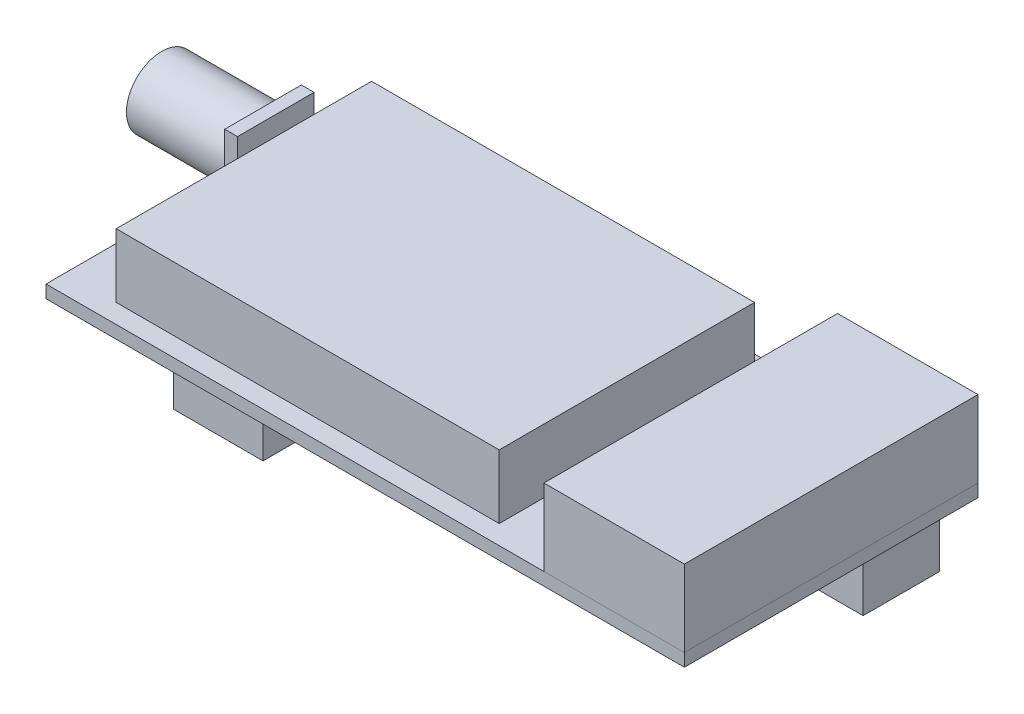
from build123d import *

# Parameters (mm, degrees)
SKETCH1_W             = 50
SKETCH1_H             = 23
BOSS_EXTRUDE1_DEPTH   = 0.5
SKETCH2_W             = 30
SKETCH2_H             = 20
BOSS_EXTRUDE2_DEPTH   = 5
SKETCH3_W             = 7
SKETCH3_H             = 7
BOSS_EXTRUDE3_DEPTH   = 4.5
SKETCH3_W_2           = 4
SKETCH3_H_2           = 6
BOSS_EXTRUDE3_2_DEPTH = 4.5
SKETCH4_W             = 6
SKETCH4_H             = 6
BOSS_EXTRUDE4_DEPTH   = 1
SKETCH5_R             = 2.75
BOSS_EXTRUDE5_DEPTH   = 8
SKETCH6_W             = 11
SKETCH6_H             = 23
BOSS_EXTRUDE6_DEPTH   = 6


with BuildPart() as part:
    # Sketch1 → Boss-Extrude1 (new, symmetric)
    with BuildSketch(Plane(origin=(0, 0, 0), x_dir=(1, 0, 0), z_dir=(0, 1, 0))):
        Rectangle(SKETCH1_W, SKETCH1_H)
    extrude(amount=BOSS_EXTRUDE1_DEPTH, both=True)


with BuildPart() as body_2:
    # Sketch2 → Boss-Extrude2 (new body)
    with BuildSketch(Plane(origin=(0, 0.5, 0), x_dir=(1, 0, 0), z_dir=(0, 1, 0))):
        with Locations((-6, 0)):
            Rectangle(SKETCH2_W, SKETCH2_H)
    extrude(amount=BOSS_EXTRUDE2_DEPTH)


with BuildPart() as body_3:
    # Sketch3 → Boss-Extrude3 (new body)
    with BuildSketch(Plane.XZ.offset(0.5)):
        with Locations((-13.5, 6)):
            Rectangle(SKETCH3_W, SKETCH3_H)
    extrude(amount=BOSS_EXTRUDE3_DEPTH)


with BuildPart() as body_4:
    # Sketch3 → Boss-Extrude3 2 (new body)
    with BuildSketch(Plane.XZ.offset(0.5)):
        with Locations((22, -6.5)):
            Rectangle(SKETCH3_W_2, SKETCH3_H_2)
    extrude(amount=BOSS_EXTRUDE3_2_DEPTH)


with BuildPart() as body_5:
    # Sketch4 → Boss-Extrude4 (new body)
    with BuildSketch(Plane.ZY.offset(25)):
        with Locations((-6.5, 0)):
            Rectangle(SKETCH4_W, SKETCH4_H)
    extrude(amount=BOSS_EXTRUDE4_DEPTH)


with BuildPart() as body_6:
    # Sketch5 → Boss-Extrude5 (new body)
    with BuildSketch(Plane.ZY.offset(26)):
        with Locations((-6.552838998, 0)):
            Circle(SKETCH5_R)
    extrude(amount=BOSS_EXTRUDE5_DEPTH)


with BuildPart() as body_7:
    # Sketch6 → Boss-Extrude6 (new body)
    with BuildSketch(Plane(origin=(0, 0.5, 0), x_dir=(1, 0, 0), z_dir=(0, 1, 0))):
        with Locations((19.5, 0)):
            Rectangle(SKETCH6_W, SKETCH6_H)
    extrude(amount=BOSS_EXTRUDE6_DEPTH)


solid = Compound([part.part, body_2.part, body_3.part, body_4.part, body_5.part, body_6.part, body_7.part])
